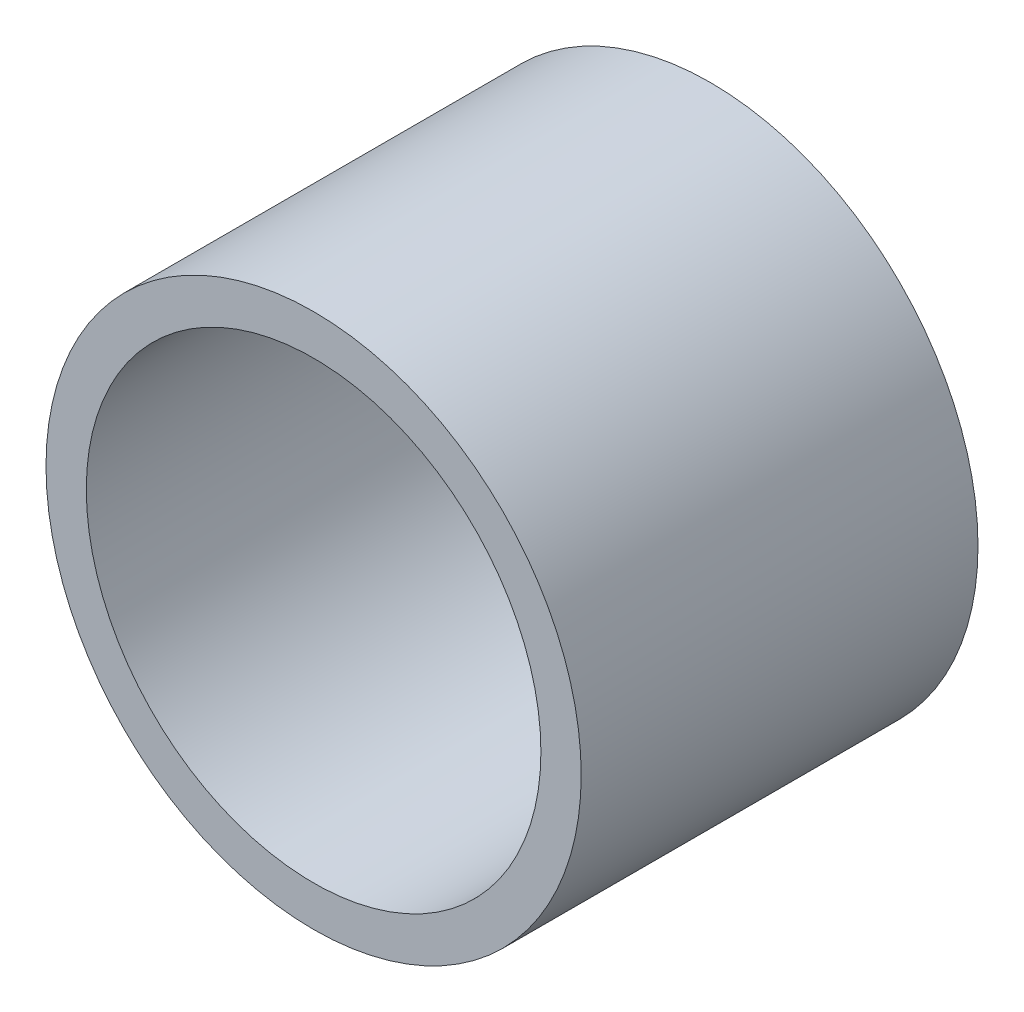
from build123d import *

# Parameters (mm, degrees)
SKETCH1_R           = 32.375
SKETCH1_R_2         = 27.5
BOSS_EXTRUDE1_DEPTH = 48.006


with BuildPart() as part:
    # Sketch1 → Boss-Extrude1 (new body)
    with BuildSketch(Plane.XY):
        Circle(SKETCH1_R)
        Circle(SKETCH1_R_2, mode=Mode.SUBTRACT)
    extrude(amount=BOSS_EXTRUDE1_DEPTH)


solid = part.part
